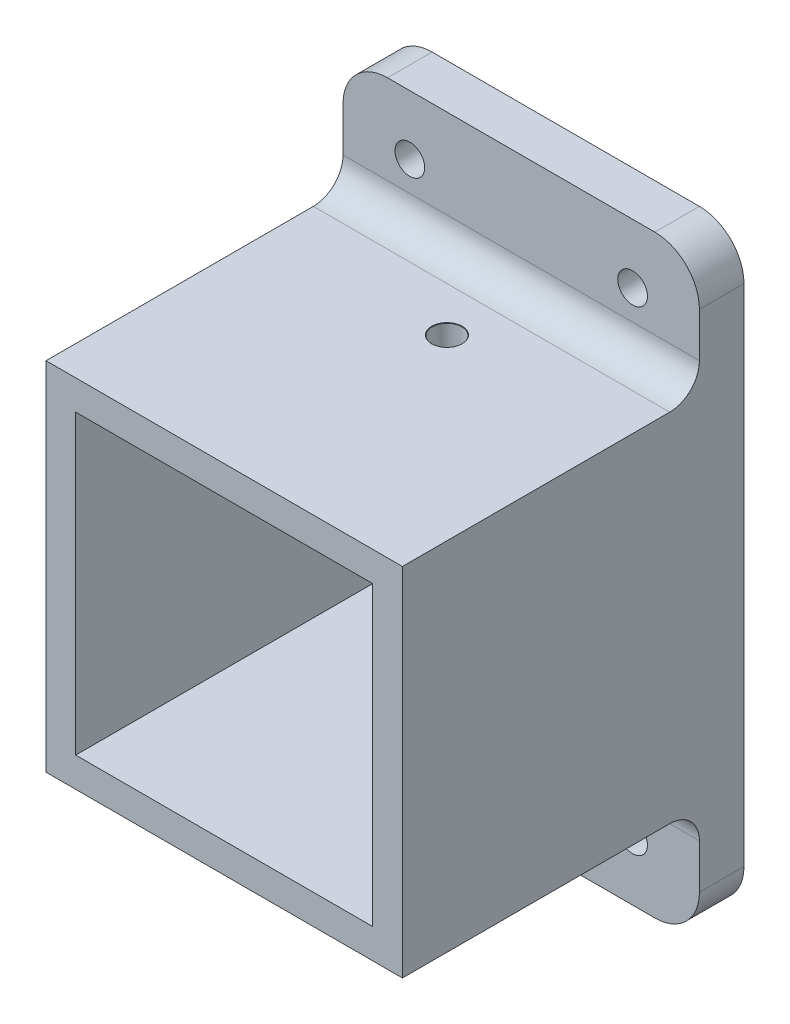
from build123d import *

# Parameters (mm, degrees)
SKETCH1_W                       = 24
SKETCH1_H                       = 24
SKETCH1_W_2                     = 20
SKETCH1_H_2                     = 20
BOSS_EXTRUDE1_DEPTH             = 20
SKETCH2_W                       = 24
SKETCH2_H                       = 8
SKETCH2_H_2                     = 24
SKETCH2_W_2                     = 20
SKETCH2_H_3                     = 20
BOSS_EXTRUDE2_DEPTH             = 3
F_2_0MM_DOWEL_HOLE1_D           = 2
F_2_0MM_DOWEL_HOLE1_CSINK_D     = 2.05
F_2_0MM_DOWEL_HOLE1_CSINK_ANGLE = 90
F_2_0MM_DOWEL_HOLE2_D           = 2
F_2_0MM_DOWEL_HOLE2_CSINK_D     = 2.05
F_2_0MM_DOWEL_HOLE2_CSINK_ANGLE = 90
FILLET1_R                       = 3
FILLET2_R                       = 2


with BuildPart() as part:
    # Sketch1 → Boss-Extrude1 (new body)
    with BuildSketch(Plane(origin=(0, 0, 0), x_dir=(0, 1, 0), z_dir=(0, 0, 1))):
        Rectangle(SKETCH1_W, SKETCH1_H)
        Rectangle(SKETCH1_W_2, SKETCH1_H_2, mode=Mode.SUBTRACT)
    extrude(amount=BOSS_EXTRUDE1_DEPTH)

    # Sketch2 → Boss-Extrude2 (add)
    # profile 1 of 4: a face of its own
    with BuildSketch(Plane(origin=(0, 0, 0), x_dir=(1, 0, 0), z_dir=(0, 0, -1))):
        with Locations((0, 16)):
            Rectangle(SKETCH2_W, SKETCH2_H)
    # profile 2 of 4: a face of its own
    with BuildSketch(Plane(origin=(0, 0, 0), x_dir=(1, 0, 0), z_dir=(0, 0, -1))):
        with Locations((0, -16)):
            Rectangle(SKETCH2_W, SKETCH2_H)
    # profile 3 of 4: a face of its own
    with BuildSketch(Plane(origin=(0, 0, 0), x_dir=(1, 0, 0), z_dir=(0, 0, -1))):
        Rectangle(SKETCH2_W, SKETCH2_H_2)
        Rectangle(SKETCH2_W_2, SKETCH2_H_3, mode=Mode.SUBTRACT)
    # profile 4 of 4: a face of its own
    with BuildSketch(Plane(origin=(0, 0, 0), x_dir=(1, 0, 0), z_dir=(0, 0, -1))):
        Rectangle(SKETCH2_W_2, SKETCH2_H_3)
    extrude(amount=BOSS_EXTRUDE2_DEPTH)

    # Ø2.0mm Dowel Hole1 (through all)
    with Locations(Plane(origin=(0, 0, -3), x_dir=(1, 0, 0), z_dir=(0, 0, -1))):
        with Locations((7.5, -16), (-27.524465522, 46.822395407), (-7.5, 16), (7.5, 16), (-7.5, -16)):
            CounterSinkHole(F_2_0MM_DOWEL_HOLE1_D / 2, F_2_0MM_DOWEL_HOLE1_CSINK_D / 2, counter_sink_angle=F_2_0MM_DOWEL_HOLE1_CSINK_ANGLE)

    # Ø2.0mm Dowel Hole2 (through all)
    with Locations(Plane(origin=(0, 12, 0), x_dir=(-1, 0, 0), z_dir=(0, 1, 0))):
        with Locations((0, 5)):
            CounterSinkHole(F_2_0MM_DOWEL_HOLE2_D / 2, F_2_0MM_DOWEL_HOLE2_CSINK_D / 2, counter_sink_angle=F_2_0MM_DOWEL_HOLE2_CSINK_ANGLE)

    # Fillet1
    fillet1_edges = [part.edges().sort_by_distance(p)[0] for p in [
        (12, -20, -1.5),
        (-12, -20, -1.5),
        (-12, 20, -1.5),
        (12, 20, -1.5),
    ]]
    fillet(fillet1_edges, radius=FILLET1_R)

    # Fillet2
    fillet2_edges = [part.edges().sort_by_distance(p)[0] for p in [
        (0, 12, 0),
        (0, -12, 0),
    ]]
    fillet(fillet2_edges, radius=FILLET2_R)


solid = part.part
